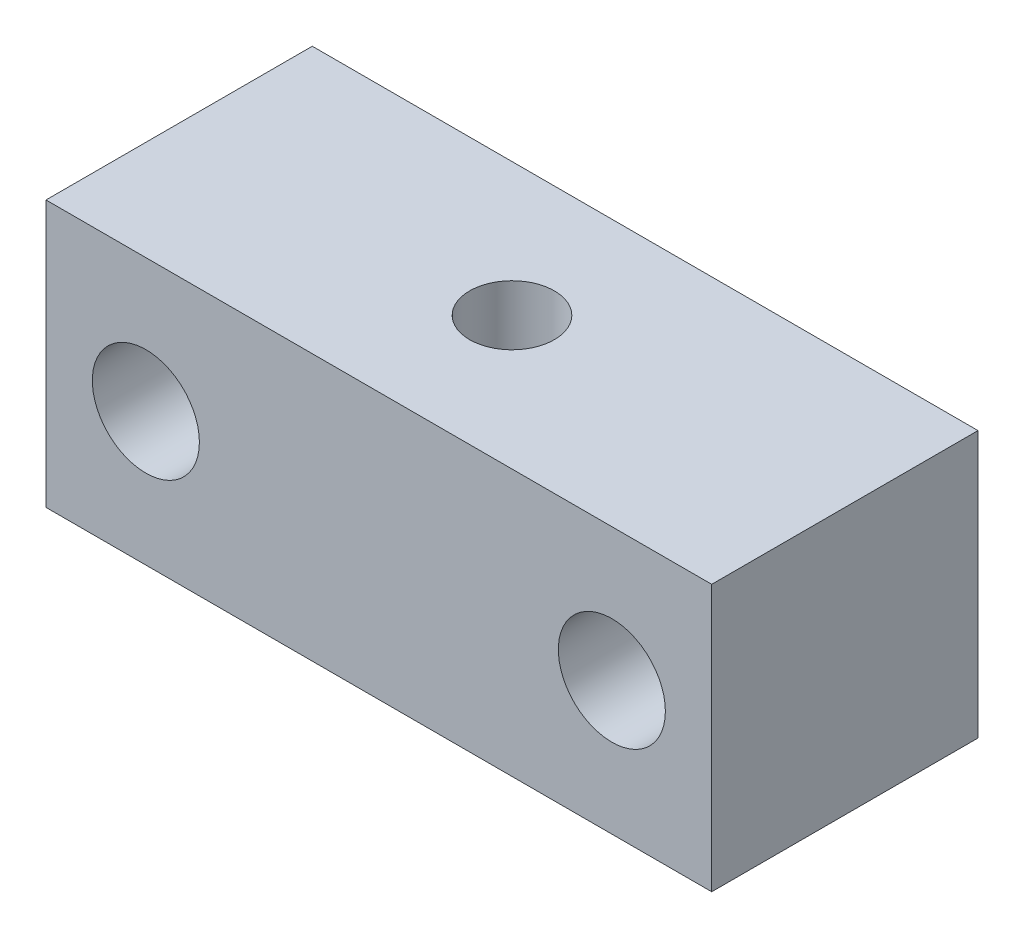
from build123d import *

# Parameters (mm, degrees)
SKETCH1_W              = 31.75
SKETCH1_H              = 12.7
BOSS_EXTRUDE1_DEPTH    = 6.35
SKETCH2_R              = 2.5527
CUT_EXTRUDE1_DEPTH     = 37.477972806
F_10_32_TAPPED_HOLE1_D = 4.0386


with BuildPart() as part:
    # Sketch1 → Boss-Extrude1 (new, symmetric)
    with BuildSketch(Plane.XY):
        with Locations((15.875, 6.35)):
            Rectangle(SKETCH1_W, SKETCH1_H)
    extrude(amount=BOSS_EXTRUDE1_DEPTH, both=True)

    # Sketch2 → Cut-Extrude1 (cut, through all)
    with BuildSketch(Plane.XY.offset(6.35)):
        with Locations((4.7625, 6.35)):
            Circle(SKETCH2_R)
        with Locations((26.9875, 6.35)):
            Circle(SKETCH2_R)
    extrude(amount=-CUT_EXTRUDE1_DEPTH, mode=Mode.SUBTRACT)

    # #10-32 Tapped Hole1 (through all)
    with Locations(Plane(origin=(15.875, 12.7, 0), x_dir=(0, 0, 1), z_dir=(0, 1, 0))):
        with Locations((0, 0)):
            Hole(F_10_32_TAPPED_HOLE1_D / 2)


solid = part.part
